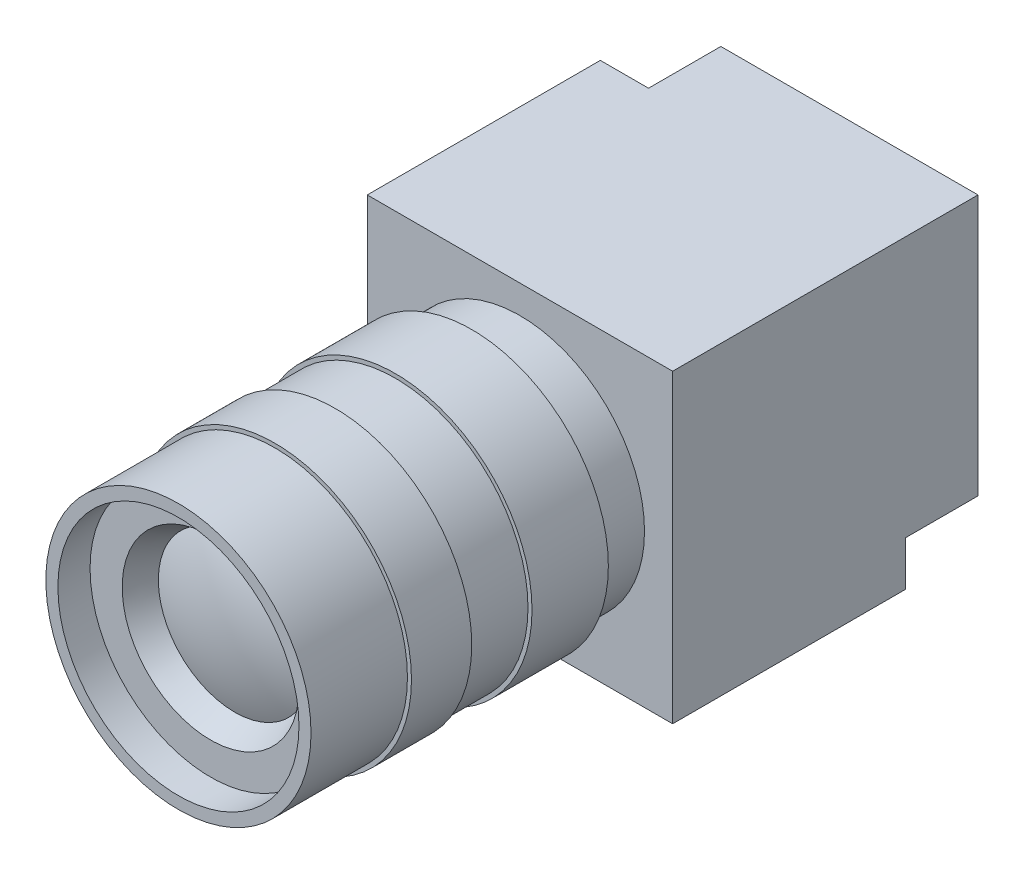
from build123d import *

# Parameters (mm, degrees)
SKETCH_1_W          = 38
SKETCH_1_H          = 38
EXTRUDE_1_DEPTH     = 38
SKETCH_2_R          = 15.5
EXTRUDE_2_DEPTH     = 6
SKETCH_3_R          = 17
EXTRUDE_3_DEPTH     = 9.5
SKETCH_4_R          = 16.5
EXTRUDE_4_DEPTH     = 7.5
SKETCH_5_R          = 17
EXTRUDE_5_DEPTH     = 7.5
SKETCH_6_R          = 16.5
EXTRUDE_6_DEPTH     = 12
CUT_EXTRUDE_1_DEPTH = 9


with BuildPart() as part:
    # 草图1 → 拉伸1 (new body)
    with BuildSketch(Plane.XY):
        Rectangle(SKETCH_1_W, SKETCH_1_H)
    extrude(amount=EXTRUDE_1_DEPTH)

    # 草图2 → 拉伸2 (add)
    with BuildSketch(Plane.XY.offset(38)):
        Circle(SKETCH_2_R)
    extrude(amount=EXTRUDE_2_DEPTH)

    # 草图3 → 拉伸3 (add)
    with BuildSketch(Plane.XY.offset(44)):
        Circle(SKETCH_3_R)
    extrude(amount=EXTRUDE_3_DEPTH)

    # 草图4 → 拉伸4 (add)
    with BuildSketch(Plane.XY.offset(53.5)):
        Circle(SKETCH_4_R)
    extrude(amount=EXTRUDE_4_DEPTH)

    # 草图5 → 拉伸5 (add)
    with BuildSketch(Plane.XY.offset(61)):
        Circle(SKETCH_5_R)
    extrude(amount=EXTRUDE_5_DEPTH)

    # 草图6 → 拉伸6 (add)
    with BuildSketch(Plane.XY.offset(68.5)):
        Circle(SKETCH_6_R)
    extrude(amount=EXTRUDE_6_DEPTH)

    # 草图8 → 切除-旋转1 (revolve, cut)
    with BuildSketch(Plane(origin=(0, 0, 0), x_dir=(1, 0, 0), z_dir=(0, 1, 0)), mode=Mode.PRIVATE) as cut_revolve_1_sk:
        with BuildLine():
            Line((0, -80.5), (-15, -80.5))
            Line((-15, -80.5), (-15, -76.5))
            Line((-15, -76.5), (-11, -76.5))
            Line((-11, -76.5), (-9.5, -73.5))
            ThreePointArc((-9.5, -73.5), (-4.842577395, -74.909003343), (0, -75.384734276))
            Line((0, -75.384734276), (0, -80.5))
        make_face()
    revolve(cut_revolve_1_sk.sketch.rotate(Axis((0, 0, 1080.5), (0, 0, -1)), 180), axis=Axis((0, 0, 1080.5), (0, 0, -1)), mode=Mode.SUBTRACT)

    # 草图9 → 切除-拉伸1 (cut)
    with BuildSketch(Plane(origin=(0, 0, 0), x_dir=(-1, 0, 0), z_dir=(0, 0, -1))):
        Polygon((-19, -19), (19, -19), (19, 19), (13, 19), (13, -4), (-11, -4), (-11, -13.44), (-19, -13.44), align=None)
    extrude(amount=-CUT_EXTRUDE_1_DEPTH, mode=Mode.SUBTRACT)


solid = part.part
